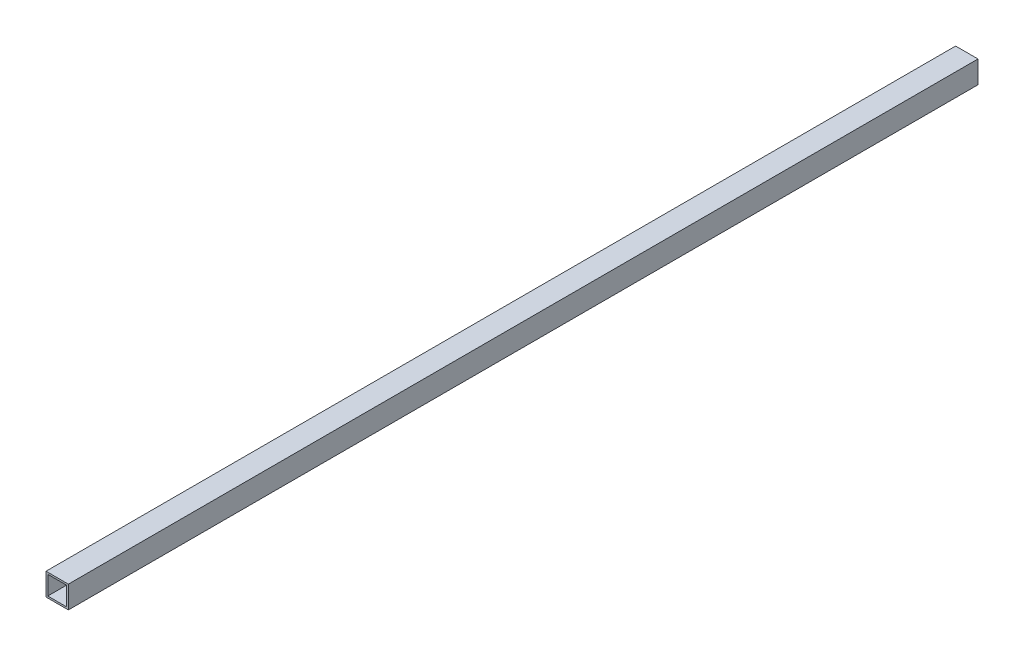
from build123d import *

# Parameters (mm, degrees)
SKETCH_1_W      = 15
SKETCH_1_H      = 15
SKETCH_1_W_2    = 12.6
SKETCH_1_H_2    = 12.6
EXTRUDE_1_DEPTH = 610


with BuildPart() as part:
    # 草图1 → 凸台-拉伸1 (new body)
    with BuildSketch(Plane.XY):
        Rectangle(SKETCH_1_W, SKETCH_1_H)
        Rectangle(SKETCH_1_W_2, SKETCH_1_H_2, mode=Mode.SUBTRACT)
    extrude(amount=EXTRUDE_1_DEPTH)


solid = part.part
